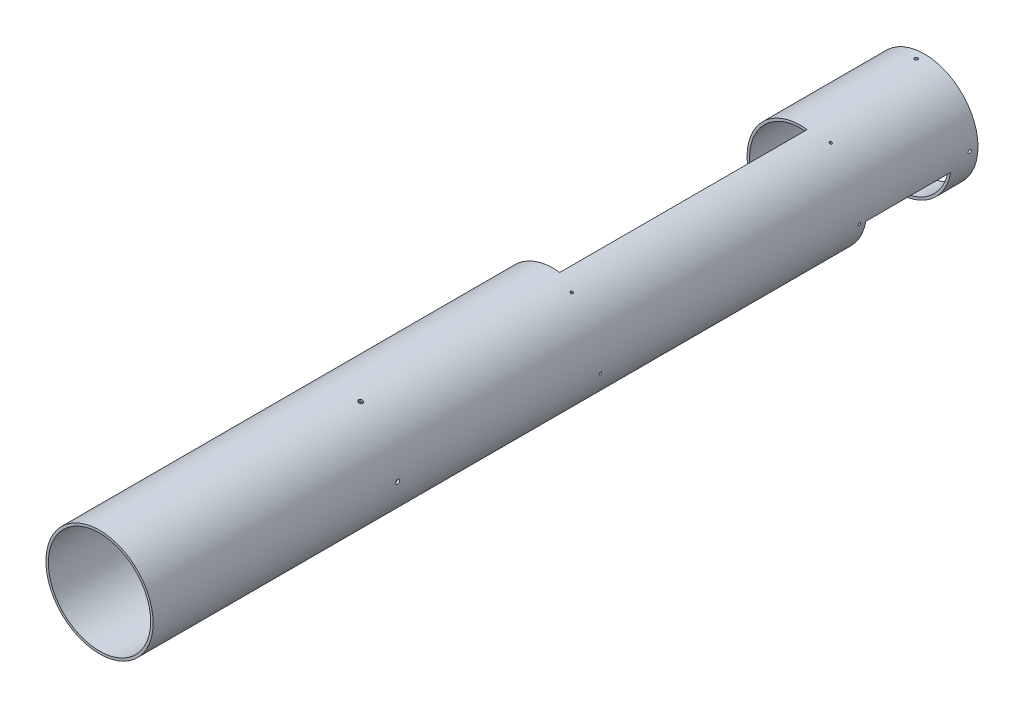
from build123d import *

# Parameters (mm, degrees)
SKETCH1_R           = 65
SKETCH1_R_2         = 62
BOSS_EXTRUDE1_DEPTH = 1000
SKETCH4_W           = 130
SKETCH4_H           = 300
CUT_EXTRUDE4_DEPTH  = 516
SKETCH5_R           = 2
CUT_EXTRUDE5_DEPTH  = 85
CIRPATTERN1_COUNT   = 4
SKETCH7_R           = 1.5
CUT_EXTRUDE6_DEPTH  = 243
CIRPATTERN2_COUNT   = 5
SKETCH8_R           = 2.5
CUT_EXTRUDE7_DEPTH  = 209
CIRPATTERN3_COUNT   = 5
CUT_EXTRUDE8_START  = -103
CUT_EXTRUDE8_DEPTH  = 103


with BuildPart() as part:
    # Sketch1 → Boss-Extrude1 (new body)
    with BuildSketch(Plane.XY):
        Circle(SKETCH1_R)
        Circle(SKETCH1_R_2, mode=Mode.SUBTRACT)
    extrude(amount=BOSS_EXTRUDE1_DEPTH)

    # Sketch4 → Cut-Extrude4 (cut)
    with BuildSketch(Plane(origin=(-28.284271247, 28.284271247, 0), x_dir=(0.7071067811865477, 0.7071067811865475, 0), z_dir=(-0.7071067811865475, 0.7071067811865477, 0))):
        with Locations((0, -300)):
            Rectangle(SKETCH4_W, SKETCH4_H)
    extrude(amount=CUT_EXTRUDE4_DEPTH, mode=Mode.SUBTRACT)

    # Sketch5 → Cut-Extrude5 (cut)
    with BuildSketch(Plane(origin=(0, 0, 0), x_dir=(1, 0, 0), z_dir=(0, 1, 0))):
        with Locations(Location((0, -10, 0), (0, 0, 270))):
            Circle(SKETCH5_R)
    cut_extrude5 = extrude(amount=-CUT_EXTRUDE5_DEPTH, mode=Mode.SUBTRACT)

    # CirPattern1: Cut-Extrude5 ×4 about axis
    cirpattern1_axis = Axis((0, 0, 1000), (0, 0, -1))
    for i in range(1, CIRPATTERN1_COUNT):
        add(cut_extrude5.rotate(cirpattern1_axis, i * 360 / CIRPATTERN1_COUNT), mode=Mode.SUBTRACT)

    # Sketch7 → Cut-Extrude6 (cut)
    with BuildSketch(Plane(origin=(-28.284271247, 28.284271247, 0), x_dir=(0.7071067811865477, 0.7071067811865475, 0), z_dir=(-0.7071067811865475, 0.7071067811865477, 0))):
        with Locations((0, -143)):
            Circle(SKETCH7_R)
        with Locations((0, -457)):
            Circle(SKETCH7_R)
    cut_extrude6 = extrude(amount=CUT_EXTRUDE6_DEPTH, mode=Mode.SUBTRACT)

    # CirPattern2: Cut-Extrude6 ×5 about axis
    cirpattern2_axis = Axis((0, 0, 1000), (0, 0, -1))
    for i in range(1, CIRPATTERN2_COUNT):
        add(cut_extrude6.rotate(cirpattern2_axis, i * 360 / CIRPATTERN2_COUNT), mode=Mode.SUBTRACT)

    # Sketch8 → Cut-Extrude7 (cut)
    with BuildSketch(Plane(origin=(0, 0, 0), x_dir=(0, 0, -1), z_dir=(1, 0, 0))):
        with Locations(Location((-703.5, 0, 0), (0, 0, 180))):
            Circle(SKETCH8_R)
    cut_extrude7 = extrude(amount=CUT_EXTRUDE7_DEPTH, mode=Mode.SUBTRACT)

    # CirPattern3: Cut-Extrude7 ×5 about axis
    cirpattern3_axis = Axis((0, 0, 1000), (0, 0, -1))
    for i in range(1, CIRPATTERN3_COUNT):
        add(cut_extrude7.rotate(cirpattern3_axis, i * 360 / CIRPATTERN3_COUNT), mode=Mode.SUBTRACT)

    # Sketch9 → Cut-Extrude8 (cut)
    with BuildSketch(Plane.XY.offset(135).offset(CUT_EXTRUDE8_START)):
        with BuildLine():
            Line((0, 0), (11.287131548, -64.012503946))
            ThreePointArc((11.287131548, -64.012503946), (45.961940777, -45.961940777), (64.012503946, -11.287131548))
            Line((64.012503946, -11.287131548), (0, 0))
        make_face()
    extrude(amount=CUT_EXTRUDE8_DEPTH, mode=Mode.SUBTRACT)


solid = part.part
